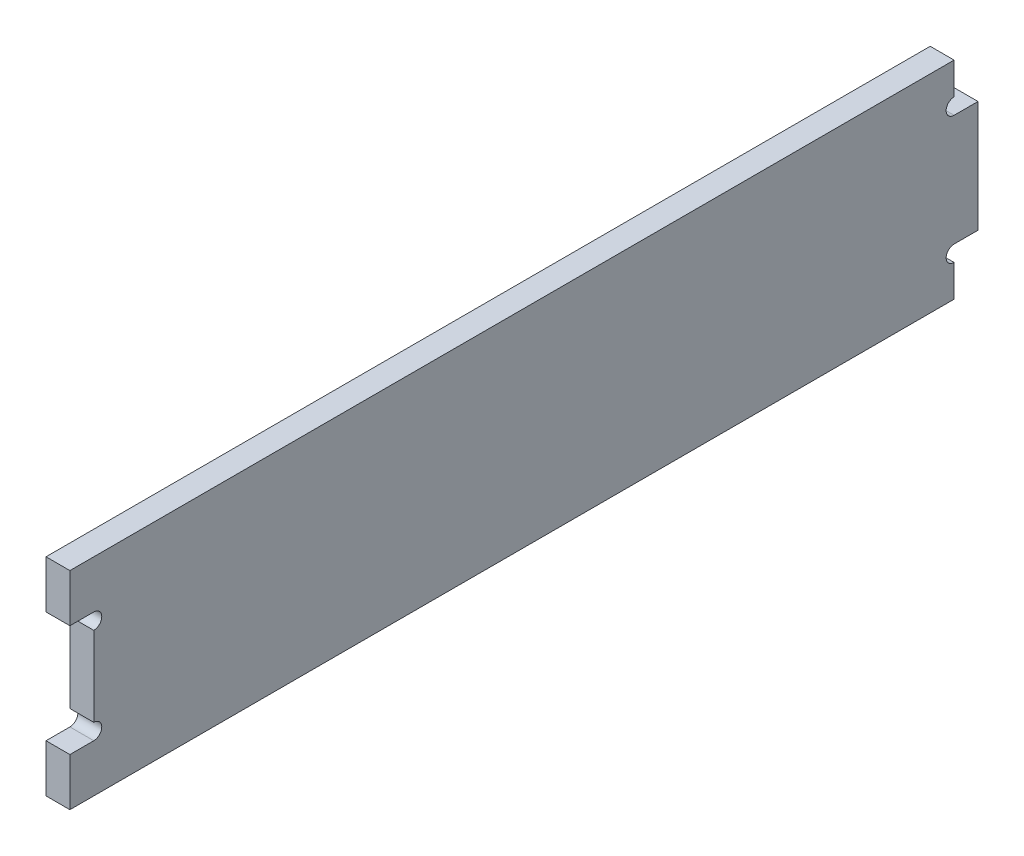
from build123d import *

# Parameters (mm, degrees)
SKETCH_1_W          = 111
SKETCH_1_H          = 26
EXTRUDE_1_DEPTH     = 3
SKETCH_2_W          = 3
SKETCH_2_H          = 14
EXTRUDE_2_DEPTH     = 3
SKETCH_3_W          = 3
SKETCH_3_H          = 14
CUT_EXTRUDE_1_DEPTH = 5
SKETCH_4_R          = 1
CUT_EXTRUDE_2_DEPTH = 10


with BuildPart() as part:
    # 스케치1 → 보스-돌출1 (new body)
    with BuildSketch(Plane(origin=(0, 0, 0), x_dir=(0, 0, -1), z_dir=(1, 0, 0))):
        with Locations((55.5, 13)):
            Rectangle(SKETCH_1_W, SKETCH_1_H)
    extrude(amount=EXTRUDE_1_DEPTH)

    # 스케치2 → 보스-돌출2 (add)
    with BuildSketch(Plane(origin=(3, 0, 0), x_dir=(0, 0, -1), z_dir=(1, 0, 0))):
        with Locations((112.5, 13)):
            Rectangle(SKETCH_2_W, SKETCH_2_H)
    extrude(amount=-EXTRUDE_2_DEPTH)

    # 스케치3 → 컷-돌출1 (cut)
    with BuildSketch(Plane(origin=(3, 0, 0), x_dir=(0, 0, -1), z_dir=(1, 0, 0))):
        with Locations((1.5, 13)):
            Rectangle(SKETCH_3_W, SKETCH_3_H)
    extrude(amount=-CUT_EXTRUDE_1_DEPTH, mode=Mode.SUBTRACT)

    # 스케치4 → 컷-돌출2 (cut)
    with BuildSketch(Plane(origin=(3, 0, 0), x_dir=(0, 0, -1), z_dir=(1, 0, 0))):
        with Locations((111, 21)):
            Circle(SKETCH_4_R)
        with Locations((111, 5)):
            Circle(SKETCH_4_R)
        with Locations((3, 19)):
            Circle(SKETCH_4_R)
        with Locations((3, 7)):
            Circle(SKETCH_4_R)
    extrude(amount=-CUT_EXTRUDE_2_DEPTH, mode=Mode.SUBTRACT)


solid = part.part
